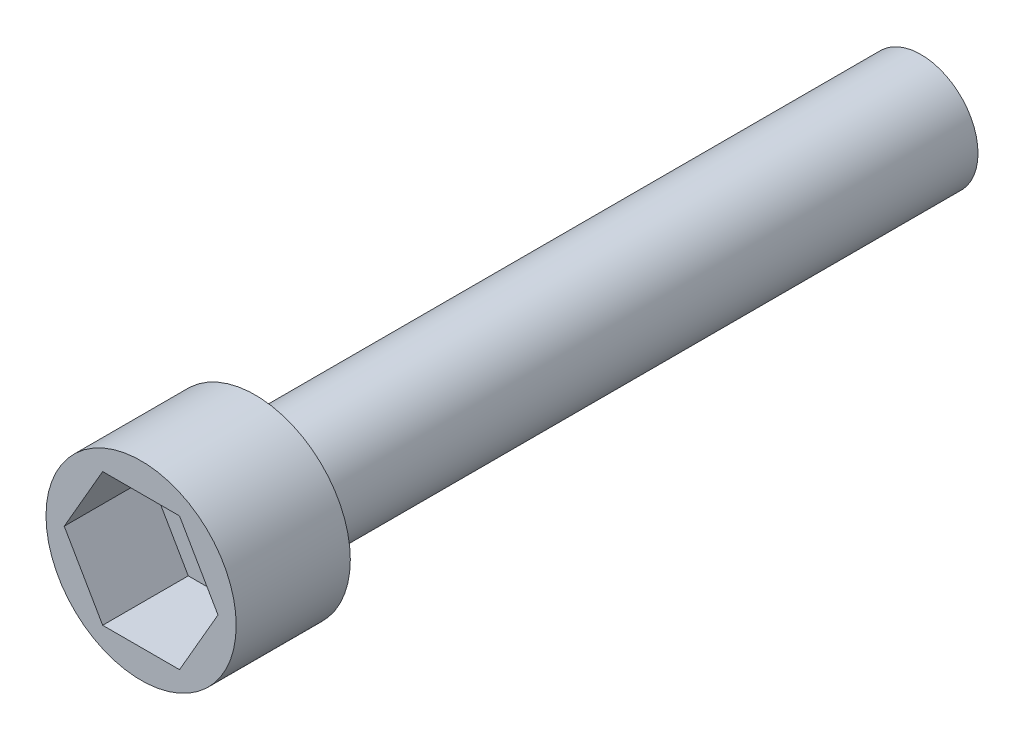
from build123d import *

# Parameters (mm, degrees)
ESQUISSE1_R             = 3
BOSS_EXTRU_1_DEPTH      = 35
ESQUISSE2_R             = 5
BOSS_EXTRU_2_DEPTH      = 6
ENL_V_MAT_EXTRU_1_DEPTH = 4.5


with BuildPart() as part:
    # Esquisse1 → Boss.-Extru.1 (new body)
    with BuildSketch(Plane.XY):
        Circle(ESQUISSE1_R)
    extrude(amount=BOSS_EXTRU_1_DEPTH)

    # Esquisse2 → Boss.-Extru.2 (add)
    with BuildSketch(Plane.XY.offset(35)):
        Circle(ESQUISSE2_R)
    extrude(amount=BOSS_EXTRU_2_DEPTH)

    # Esquisse3 → Enlèv. mat.-Extru.1 (cut)
    with BuildSketch(Plane.XY.offset(41)):
        Polygon((4.041451884, 0), (2.020725942, 3.5), (-2.020725942, 3.5), (-4.041451884, 0), (-2.020725942, -3.5), (2.020725942, -3.5), align=None)
    extrude(amount=-ENL_V_MAT_EXTRU_1_DEPTH, mode=Mode.SUBTRACT)


solid = part.part
